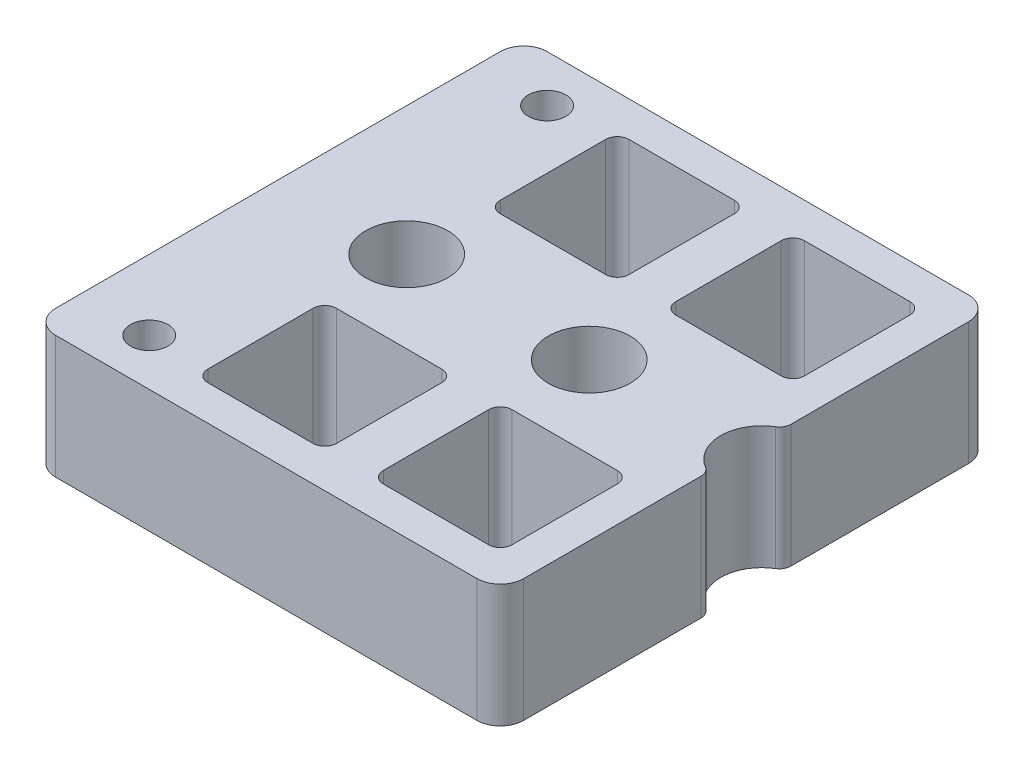
from build123d import *
from build123d.topology import SkipClean

# Parameters (mm, degrees)
SKETCH_1_W          = 40
SKETCH_1_H          = 42
SKETCH_1_R          = 1.6
EXTRUDE_1_DEPTH     = 10.5
FILLET_1_R          = 2
SKETCH_2_R          = 1.6
CUT_EXTRUDE_1_DEPTH = 89.183048258
EXTRUDE_START       = -10.5
SKETCH_3_R          = 1.6
EXTRUDE_2_DEPTH     = 10.5
SKETCH_4_R          = 3.5
CUT_EXTRUDE_2_DEPTH = 5
CUT_EXTRUDE_3_DEPTH = 88.728273664
SKETCH_6_W          = 11
SKETCH_6_H          = 11
CUT_EXTRUDE_4_DEPTH = 89.183048258
FILLET_2_R          = 1


with BuildPart() as part:
    # 草图1 → 凸台-拉伸1 (new body)
    with BuildSketch(Plane(origin=(0, 0, 0), x_dir=(1, 0, 0), z_dir=(0, 1, 0))):
        with Locations((-65, 0)):
            Rectangle(SKETCH_1_W, SKETCH_1_H)
        with Locations(Location((-79, -17, 0), (0, 0, 90))):
            Circle(SKETCH_1_R, mode=Mode.SUBTRACT)
        with Locations(Location((-69, 0, 0), (0, 0, 90))):
            Circle(SKETCH_1_R, mode=Mode.SUBTRACT)
        with Locations(Location((-79, 17, 0), (0, 0, 90))):
            Circle(SKETCH_1_R, mode=Mode.SUBTRACT)
    extrude(amount=EXTRUDE_1_DEPTH)

    # 圆角1
    fillet_1_edges = [part.edges().sort_by_distance(p)[0] for p in [
        (-45, 5.25, -21),
        (-45, 5.25, 21),
        (-85, 5.25, 21),
        (-85, 5.25, -21),
    ]]
    fillet(fillet_1_edges, radius=FILLET_1_R)

    # 草图2 → 切除-拉伸1 (cut, through all)
    with BuildSketch(Plane(origin=(0, 10.5, 0), x_dir=(1, 0, 0), z_dir=(0, 1, 0))):
        with Locations(Location((-74, 0, 0), (0, 0, 270))):
            Circle(SKETCH_2_R)
        with Locations((-44, 0)):
            Circle(SKETCH_2_R)
        with Locations(Location((-58.4, 0, 0), (0, 0, 270))):
            Circle(SKETCH_2_R)
    extrude(amount=-CUT_EXTRUDE_1_DEPTH, mode=Mode.SUBTRACT)

    # 草图3 → 凸台-拉伸2 (add)
    with BuildSketch(Plane(origin=(0, 10.5, 0), x_dir=(1, 0, 0), z_dir=(0, 1, 0)).offset(EXTRUDE_START)):
        with Locations((-69, 0)):
            Circle(SKETCH_3_R)
    extrude(amount=EXTRUDE_2_DEPTH)

    # 草图4 → 切除-拉伸2 (cut)
    with BuildSketch(Plane(origin=(0, 10.5, 0), x_dir=(1, 0, 0), z_dir=(0, 1, 0))):
        with Locations(Location((-74, 0, 0), (0, 0, 270))):
            Circle(SKETCH_4_R)
        with Locations(Location((-58.4, 0, 0), (0, 0, 270))):
            Circle(SKETCH_4_R)
        with Locations((-43.663101604, 0)):
            Circle(SKETCH_4_R)
    extrude(amount=-CUT_EXTRUDE_2_DEPTH, mode=Mode.SUBTRACT)

    # 草图5 → 切除-拉伸3 (cut, through all)
    with SkipClean():  # the faces are left unmerged after this step: merging them gives an invalid solid
        with BuildSketch(Plane(origin=(0, 5.5, 0), x_dir=(1, 0, 0), z_dir=(0, 1, 0))):
            with BuildLine():
                Line((-45, 3.234610128), (-45, -3.234610128))
                ThreePointArc((-45, -3.234610128), (-47.163101604, 0), (-45, 3.234610128))
            make_face()
        extrude(amount=-CUT_EXTRUDE_3_DEPTH, mode=Mode.SUBTRACT)

    # 草图6 → 切除-拉伸4 (cut, through all)
    with SkipClean():  # the faces are left unmerged after this step: merging them gives an invalid solid
        with BuildSketch(Plane(origin=(0, 10.5, 0), x_dir=(1, 0, 0), z_dir=(0, 1, 0))):
            with Locations((-68.5, 12.5)):
                Rectangle(SKETCH_6_W, SKETCH_6_H)
            with Locations((-53.5, 12.5)):
                Rectangle(SKETCH_6_W, SKETCH_6_H)
            with Locations((-68.5, -12.5)):
                Rectangle(SKETCH_6_W, SKETCH_6_H)
            with Locations((-53.5, -12.5)):
                Rectangle(SKETCH_6_W, SKETCH_6_H)
        extrude(amount=-CUT_EXTRUDE_4_DEPTH, mode=Mode.SUBTRACT)

    # 圆角2
    fillet_2_edges = [part.edges().sort_by_distance(p)[0] for p in [
        (-59, 5.25, -18),
        (-48, 5.25, -18),
        (-48, 5.25, -7),
        (-59, 5.25, -7),
        (-74, 5.25, 7),
        (-63, 5.25, 7),
        (-63, 5.25, 18),
        (-74, 5.25, 18),
        (-59, 5.25, 7),
        (-48, 5.25, 7),
        (-48, 5.25, 18),
        (-59, 5.25, 18),
        (-63, 5.25, -18),
        (-63, 5.25, -7),
        (-74, 5.25, -7),
        (-74, 5.25, -18),
        (-45, 2.75, -3.234610128),
        (-45, 2.75, 3.234610128),
    ]]
    fillet(fillet_2_edges, radius=FILLET_2_R)


solid = part.part
